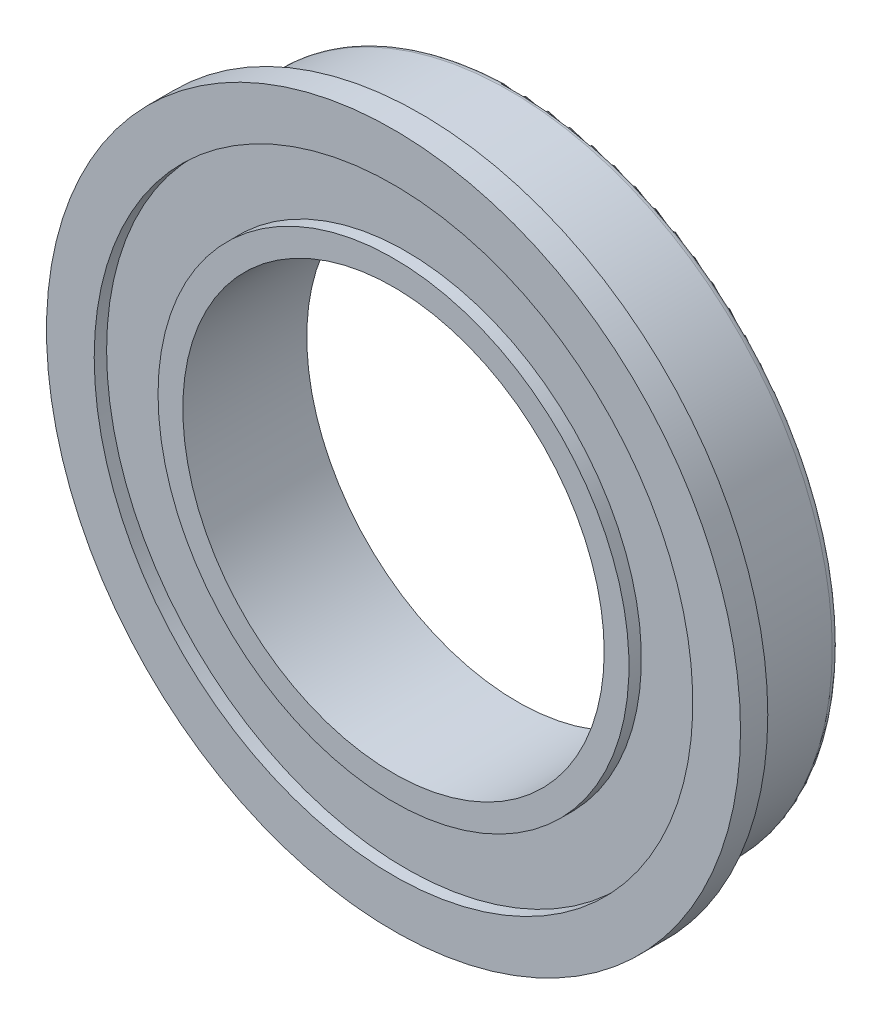
from build123d import *

# Parameters (mm, degrees)
SKETCH_1_R      = 13
SKETCH_1_R_2    = 8.5
EXTRUDE_1_DEPTH = 5
EXTRUDE_START   = -1.1
SKETCH_2_R      = 14
SKETCH_2_R_2    = 13
EXTRUDE_2_DEPTH = 1.1
FILLET_1_R      = 0.3
SKETCH_3_W      = 0.5
SKETCH_3_H      = 2.575


with BuildPart() as part:
    # 草图1 → 凸台-拉伸1 (new body)
    with BuildSketch(Plane.XY):
        Circle(SKETCH_1_R)
        Circle(SKETCH_1_R_2, mode=Mode.SUBTRACT)
    extrude(amount=EXTRUDE_1_DEPTH)

    # 草图2 → 凸台-拉伸2 (add)
    with BuildSketch(Plane.XY.offset(5).offset(EXTRUDE_START)):
        Circle(SKETCH_2_R)
        Circle(SKETCH_2_R_2, mode=Mode.SUBTRACT)
    extrude(amount=EXTRUDE_2_DEPTH)

    # 圆角1
    fillet_1_edges = [part.edges().sort_by_distance(p)[0] for p in [
        (-13, 0, 0),
    ]]
    fillet(fillet_1_edges, radius=FILLET_1_R)

    # 草图3 → 切除-旋转1 (revolve, cut)
    with BuildSketch(Plane(origin=(0, 0, 0), x_dir=(0, 0, -1), z_dir=(1, 0, 0)), mode=Mode.PRIVATE) as cut_revolve_1_sk:
        with Locations((-0.25, 10.7875)):
            Rectangle(SKETCH_3_W, SKETCH_3_H)
        with Locations((-4.75, 10.7875)):
            Rectangle(SKETCH_3_W, SKETCH_3_H)
    revolve(cut_revolve_1_sk.sketch.rotate(Axis((0, 0, 0), (0, 0, 1)), 90), axis=Axis((0, 0, 0), (0, 0, 1)), mode=Mode.SUBTRACT)


solid = part.part
